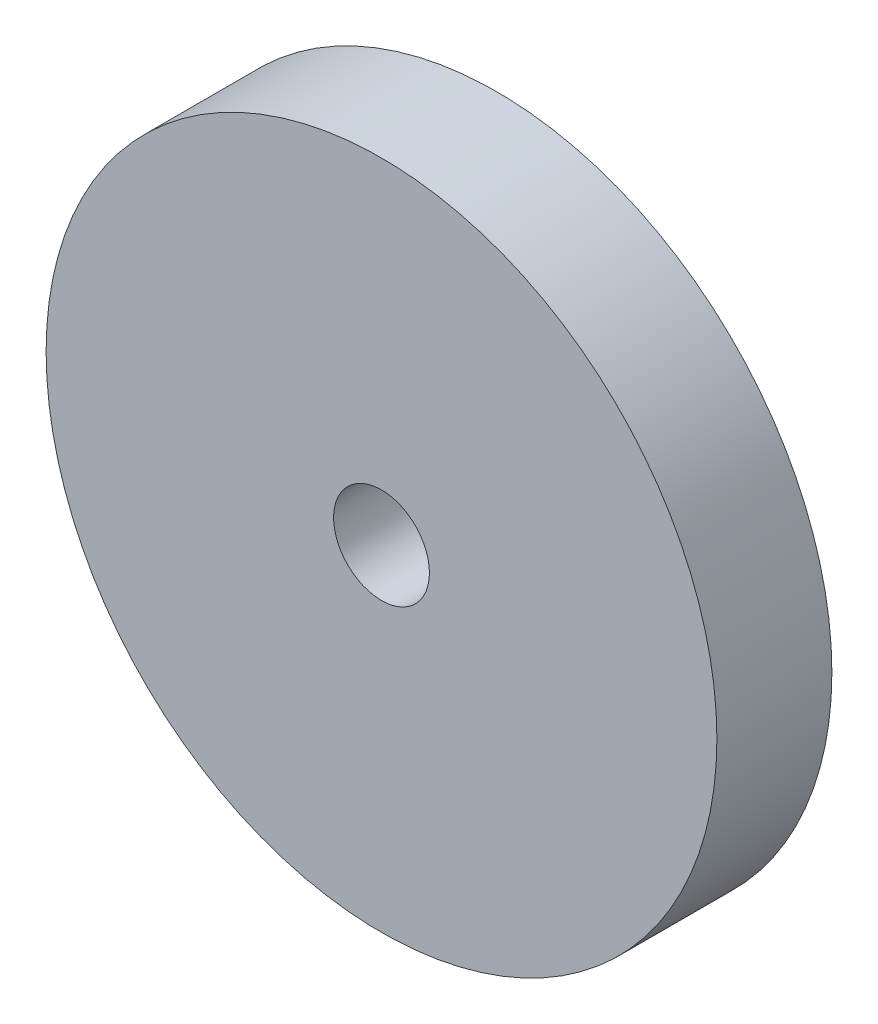
from build123d import *

# Parameters (mm, degrees)
SKETCH_1_R      = 8.75
SKETCH_1_R_2    = 1.25
EXTRUDE_1_DEPTH = 3


with BuildPart() as part:
    # 草圖1 → 填料-伸長1 (new body)
    with BuildSketch(Plane.XY):
        Circle(SKETCH_1_R)
        Circle(SKETCH_1_R_2, mode=Mode.SUBTRACT)
    extrude(amount=EXTRUDE_1_DEPTH)


solid = part.part
